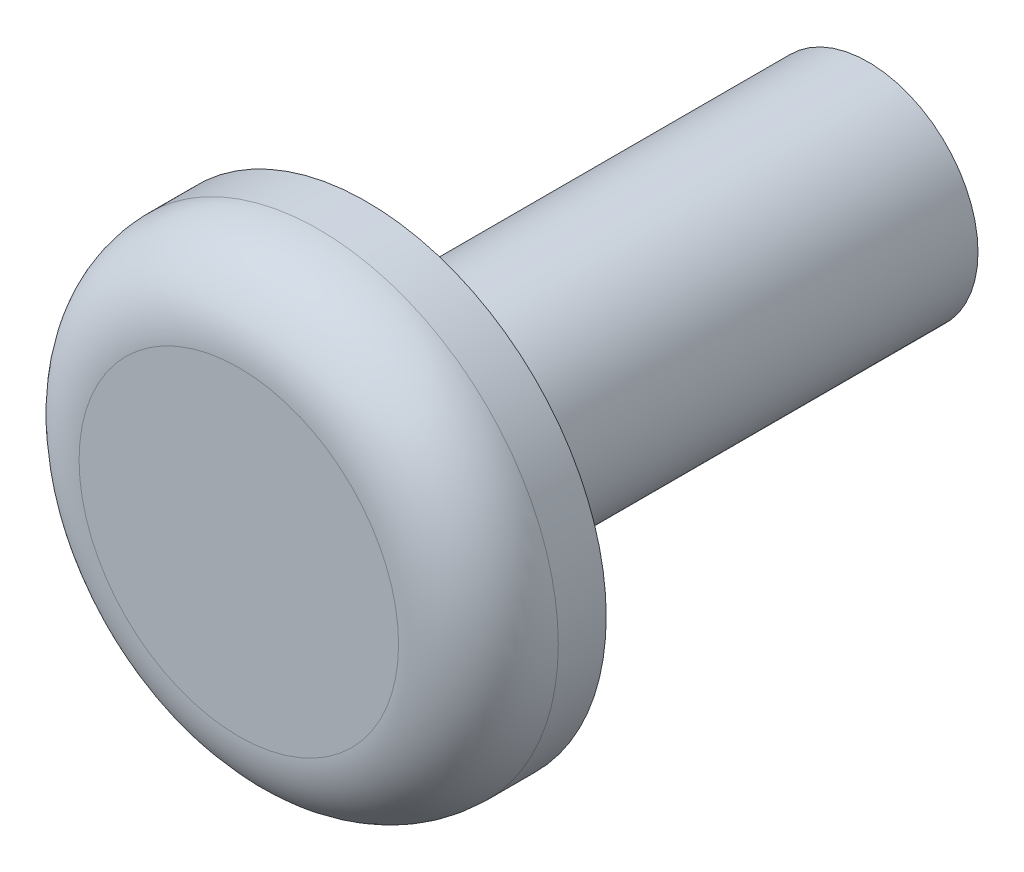
from build123d import *

# Parameters (mm, degrees)
SKETCH1_R           = 3.4375
BOSS_EXTRUDE1_DEPTH = 15.7
SKETCH2_R           = 7.5
BOSS_EXTRUDE2_DEPTH = 4
SKETCH3_R           = 1.5
CUT_EXTRUDE1_DEPTH  = 5
CHAMFER1_SIZE       = 0.2
CHAMFER1_SIZE2      = 1
FILLET1_R           = 2.5


with BuildPart() as part:
    # Sketch1 → Boss-Extrude1 (new body)
    with BuildSketch(Plane.XY):
        Circle(SKETCH1_R)
    extrude(amount=BOSS_EXTRUDE1_DEPTH)

    # Sketch2 → Boss-Extrude2 (add)
    with BuildSketch(Plane.XY.offset(15.7)):
        Circle(SKETCH2_R)
    extrude(amount=BOSS_EXTRUDE2_DEPTH)

    # Sketch3 → Cut-Extrude1 (cut)
    with BuildSketch(Plane(origin=(0, 0, 0), x_dir=(-1, 0, 0), z_dir=(0, 0, -1))):
        Circle(SKETCH3_R)
    extrude(amount=-CUT_EXTRUDE1_DEPTH, mode=Mode.SUBTRACT)

    # Chamfer1
    chamfer1_edges = [part.edges().sort_by_distance(p)[0] for p in [
        (1.5, 0, 0),
    ]]
    chamfer1_side = [part.faces().sort_by_distance(p)[0] for p in [
        (-3.340272818, 0, 0),
    ]]
    chamfer(chamfer1_edges, length=CHAMFER1_SIZE, length2=CHAMFER1_SIZE2, reference=chamfer1_side[0])

    # Fillet1
    fillet1_edges = [part.edges().sort_by_distance(p)[0] for p in [
        (-7.5, 0, 19.7),
    ]]
    fillet(fillet1_edges, radius=FILLET1_R)


solid = part.part
